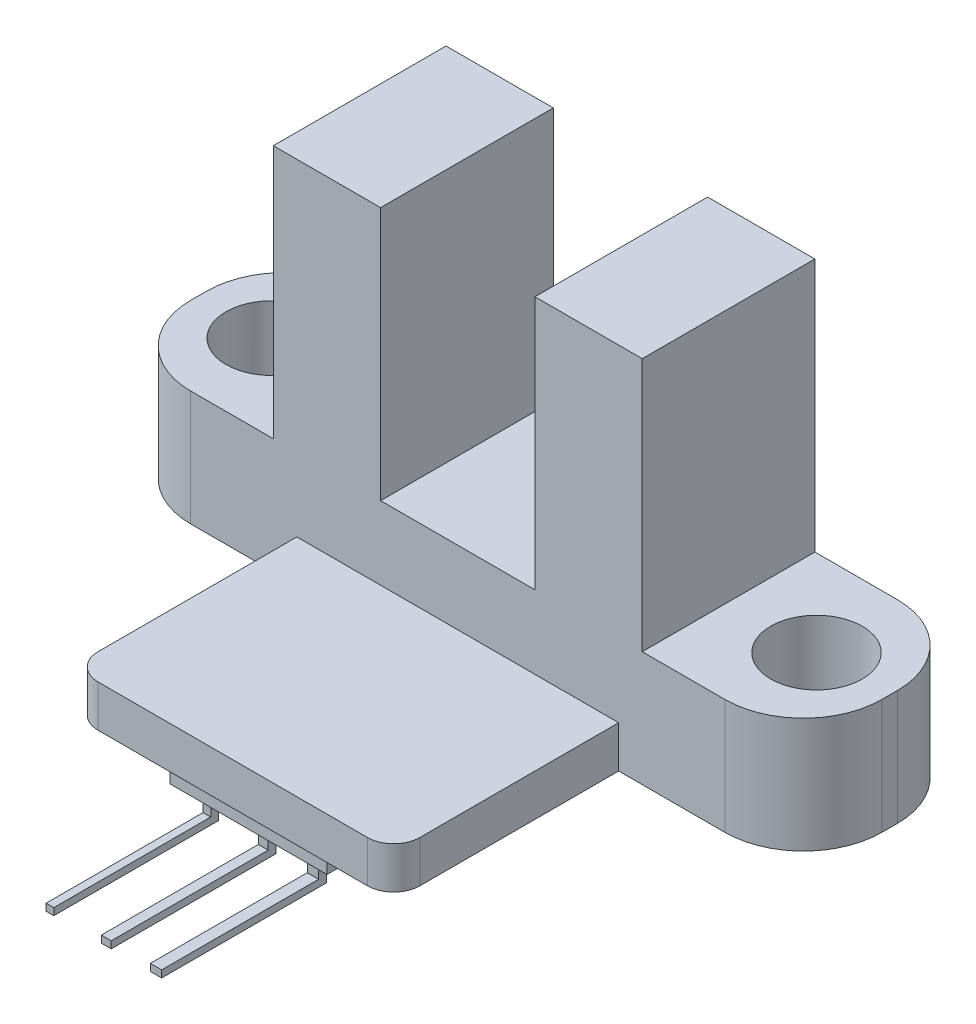
from build123d import *

# Parameters (mm, degrees)
SKETCH_1_W          = 26.42
SKETCH_1_H          = 6.6
EXTRUDE_1_DEPTH     = 4.4
SKETCH_2_W          = 12.3
SKETCH_2_H          = 8.6
EXTRUDE_2_DEPTH     = 1.6
SKETCH_3_W          = 4.1
SKETCH_3_H          = 6.6
EXTRUDE_3_DEPTH     = 9.7
FILLET_1_R          = 3
FILLET_2_R          = 1
SKETCH_4_W          = 6
SKETCH_4_H          = 1
EXTRUDE_4_DEPTH     = 1
SKETCH_5_W          = 0.293200104
SKETCH_5_H          = 0.293200104
SKETCH_5_W_2        = 0.377208019
SKETCH_5_W_3        = 0.433090687
EXTRUDE_5_DEPTH     = 1
SKETCH_6_W          = 0.293200104
SKETCH_6_H          = 0.267980564
SKETCH_6_W_2        = 0.377208019
SKETCH_6_W_3        = 0.433090687
EXTRUDE_6_DEPTH     = 6
SKETCH_7_R          = 1.75
CUT_EXTRUDE_1_DEPTH = 6


with BuildPart() as part:
    # 草图1 → 凸台-拉伸1 (new body)
    with BuildSketch(Plane(origin=(0, 0, 0), x_dir=(1, 0, 0), z_dir=(0, 1, 0))):
        with Locations((13.21, 3.3)):
            Rectangle(SKETCH_1_W, SKETCH_1_H)
    extrude(amount=EXTRUDE_1_DEPTH)

    # 草图2 → 凸台-拉伸2 (add)
    with BuildSketch(Plane(origin=(0, 0, 0), x_dir=(-1, 0, 0), z_dir=(0, -1, 0))):
        with Locations((-13.21, -4.3)):
            Rectangle(SKETCH_2_W, SKETCH_2_H)
    extrude(amount=-EXTRUDE_2_DEPTH)

    # 草图3 → 凸台-拉伸3 (add)
    with BuildSketch(Plane(origin=(0, 4.4, 0), x_dir=(1, 0, 0), z_dir=(0, 1, 0))):
        with Locations((8.21, 3.3)):
            Rectangle(SKETCH_3_W, SKETCH_3_H)
        with Locations((18.21, 3.3)):
            Rectangle(SKETCH_3_W, SKETCH_3_H)
    extrude(amount=EXTRUDE_3_DEPTH)

    # 圆角1
    fillet_1_edges = [part.edges().sort_by_distance(p)[0] for p in [
        (0, 2.2, -6.6),
        (26.42, 2.2, -6.6),
        (26.42, 2.2, 0),
        (0, 2.2, 0),
    ]]
    fillet(fillet_1_edges, radius=FILLET_1_R)

    # 圆角2
    fillet_2_edges = [part.edges().sort_by_distance(p)[0] for p in [
        (7.06, 0.8, 8.6),
        (19.36, 0.8, 8.6),
    ]]
    fillet(fillet_2_edges, radius=FILLET_2_R)

    # 草图4 → 凸台-拉伸4 (add)
    with BuildSketch(Plane(origin=(0, 0, 0), x_dir=(-1, 0, 0), z_dir=(0, -1, 0))):
        with Locations((-13.21, -7.5)):
            Rectangle(SKETCH_4_W, SKETCH_4_H)
    extrude(amount=EXTRUDE_4_DEPTH)

    # 草图5 → 凸台-拉伸5 (add)
    with BuildSketch(Plane(origin=(0, -1, 0), x_dir=(-1, 0, 0), z_dir=(0, -1, 0))):
        with Locations((-11.206465954, -7.438185624)):
            Rectangle(SKETCH_5_W, SKETCH_5_H)
        with Locations((-13.359332723, -7.438185624)):
            Rectangle(SKETCH_5_W_2, SKETCH_5_H)
        with Locations((-15.259343482, -7.438185624)):
            Rectangle(SKETCH_5_W_3, SKETCH_5_H)
    extrude(amount=EXTRUDE_5_DEPTH)

    # 草图6 → 凸台-拉伸6 (add)
    with BuildSketch(Plane.XY.offset(7.584785676)):
        with Locations((11.206465954, -1.866009718)):
            Rectangle(SKETCH_6_W, SKETCH_6_H)
        with Locations((13.359332723, -1.866009718)):
            Rectangle(SKETCH_6_W_2, SKETCH_6_H)
        with Locations((15.259343482, -1.866009718)):
            Rectangle(SKETCH_6_W_3, SKETCH_6_H)
    extrude(amount=EXTRUDE_6_DEPTH)

    # 草图7 → 切除-拉伸1 (cut)
    with BuildSketch(Plane(origin=(0, 4.4, 0), x_dir=(1, 0, 0), z_dir=(0, 1, 0))):
        with Locations(Location((2.8, 3.3, 0), (0, 0, 270))):
            Circle(SKETCH_7_R)
        with Locations(Location((23.62, 3.3, 0), (0, 0, 270))):
            Circle(SKETCH_7_R)
    extrude(amount=-CUT_EXTRUDE_1_DEPTH, mode=Mode.SUBTRACT)


solid = part.part
